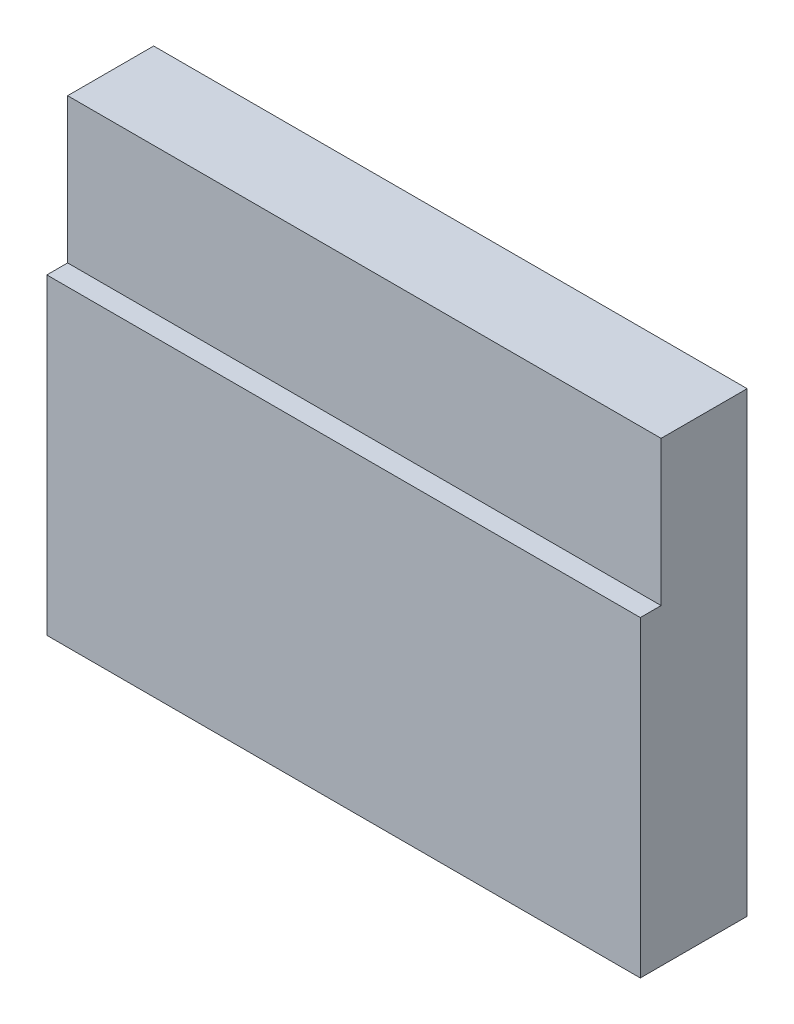
from build123d import *

# Parameters (mm, degrees)
SKETCH2_W           = 100
SKETCH2_H           = 77
BOSS_EXTRUDE1_DEPTH = 18
SKETCH3_W           = 100
SKETCH3_H           = 24.402527788
CUT_EXTRUDE1_DEPTH  = 3.5


with BuildPart() as part:
    # Sketch2 → Boss-Extrude1 (new body)
    with BuildSketch(Plane.XY.offset(-10)):
        with Locations((45, 33.5)):
            Rectangle(SKETCH2_W, SKETCH2_H)
    extrude(amount=BOSS_EXTRUDE1_DEPTH)

    # Sketch3 → Cut-Extrude1 (cut)
    with BuildSketch(Plane.XY.offset(8)):
        with Locations((45, 59.798736106)):
            Rectangle(SKETCH3_W, SKETCH3_H)
    extrude(amount=-CUT_EXTRUDE1_DEPTH, mode=Mode.SUBTRACT)


solid = part.part
